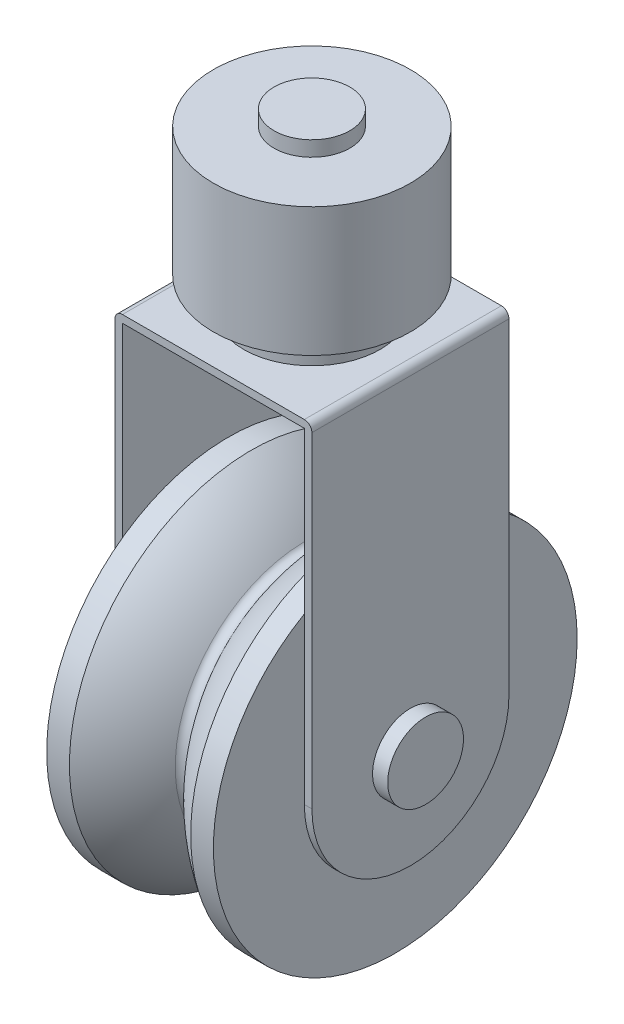
from build123d import *

# Parameters (mm, degrees)
FILLET_1_R                  = 1
EXTRUDE_1_DEPTH             = 13
EXTRUDE_3_DEPTH             = 1
EXTRUDE_4_REACH             = 58.462
SKETCH_5_R                  = 5
EXTRUDE_4_DIRECTION_2_DEPTH = 2
SKETCH_8_R                  = 9
EXTRUDE_5_DEPTH             = 4
SKETCH_9_R                  = 13
EXTRUDE_6_DEPTH             = 17
SKETCH_10_R                 = 5
EXTRUDE_7_DEPTH             = 2
FILLET_3_R                  = 1


with BuildPart() as part:
    # 草图1 → 旋转1 (revolve)
    with BuildSketch(Plane.XY, mode=Mode.PRIVATE) as revolve_1_sk:
        with BuildLine():
            Line((-11, 0), (0, 0))
            Line((0, 0), (0, 16))
            add(Edge.make_bspline(
                [(0, 16), (-3.200328023, 21.071332496), (-8, 24)],
                knots=[0, 0, 0, 0.822363045, 0.822363045, 0.822363045], degree=2))
            Line((-8, 24), (-11, 24))
            Line((-11, 24), (-11, 0))
        make_face()
        with BuildLine():
            Line((0, 16), (0, 0))
            Line((0, 0), (11, 0))
            Line((11, 0), (11, 24))
            Line((11, 24), (8, 24))
            add(Edge.make_bspline(
                [(0, 16), (3.200328023, 21.071332496), (8, 24)],
                knots=[0, 0, 0, 0.822363045, 0.822363045, 0.822363045], degree=2))
        make_face()
    revolve(revolve_1_sk.sketch.rotate(Axis((11, 0, 0), (-1, 0, 0)), 90), axis=Axis((11, 0, 0), (-1, 0, 0)))

    # 圆角1
    fillet_1_edges = [part.edges().sort_by_distance(p)[0] for p in [
        (0, 0, 16),
    ]]
    fillet(fillet_1_edges, radius=FILLET_1_R)

    # 凸台-拉伸4: up to this face of the body (flat: up to its plane)
    extrude_4_end = Plane(part.part.faces().sort_by_distance((11, 0, 0))[0])
    # 草图5 → 凸台-拉伸4 (add, up to the picked face)
    with BuildSketch(Plane(origin=(13, 0, 0), x_dir=(0, 0, -1), z_dir=(1, 0, 0)), mode=Mode.PRIVATE) as extrude_4_sk1:
        with Locations(Location((0, 0, 0), (0, 0, 180))):
            Circle(SKETCH_5_R)
    extrude_4_tool1 = split(extrude(extrude_4_sk1.sketch, amount=-EXTRUDE_4_REACH, mode=Mode.PRIVATE), bisect_by=extrude_4_end, keep=Keep.BOTH, mode=Mode.PRIVATE)


with BuildPart() as body_2:
    # 草图2 → 凸台-拉伸1 (new, symmetric)
    with BuildSketch(Plane.XY):
        Polygon((-12, 0), (-12, 43), (12, 43), (12, 0), (13, 0), (13, 44), (-13, 44), (-13, 0), align=None)
    extrude(amount=EXTRUDE_1_DEPTH, both=True)


with BuildPart() as body_3:
    # 草图4 → 凸台-拉伸3 (new body)
    with BuildSketch(Plane(origin=(13, 0, 0), x_dir=(0, 0, -1), z_dir=(1, 0, 0))):
        with BuildLine():
            ThreePointArc((13, 0), (0, -13), (-13, 0))
            Line((-13, 0), (13, 0))
        make_face()
    extrude(amount=-EXTRUDE_3_DEPTH)


with BuildPart() as part_1:
    add(part.part)

    add(body_2.part)  # 凸台-拉伸4 merges body 2

    add(body_3.part)  # 凸台-拉伸4 merges body 3
    add(extrude_4_tool1.solids().sort_by(Axis((13, 0, 0), (-1, 0, 0)))[0])

    # 草图5 → 凸台-拉伸4 direction 2 (add)
    with BuildSketch(Plane(origin=(13, 0, 0), x_dir=(0, 0, -1), z_dir=(1, 0, 0))):
        with Locations(Location((0, 0, 0), (0, 0, 180))):
            Circle(SKETCH_5_R)
    extrude(amount=EXTRUDE_4_DIRECTION_2_DEPTH)


with BuildPart() as body_2_2:
    # 镜向9: mirrored copy
    add(part_1.part.mirror(Plane(origin=(0, 0, 0), x_dir=(0, 0, 1), z_dir=(1, 0, 0))))


with BuildPart() as part_2:
    add(part_1.part)

    add(body_2_2.part)  # 凸台-拉伸5 merges body 2 2
    # 草图8 → 凸台-拉伸5 (add)
    with BuildSketch(Plane(origin=(0, 44, 0), x_dir=(1, 0, 0), z_dir=(0, 1, 0))):
        with Locations(Location((0, 0, 0), (0, 0, 270))):
            Circle(SKETCH_8_R)
    extrude(amount=EXTRUDE_5_DEPTH)

    # 草图9 → 凸台-拉伸6 (add)
    with BuildSketch(Plane(origin=(0, 48, 0), x_dir=(1, 0, 0), z_dir=(0, 1, 0))):
        with Locations(Location((0, 0, 0), (0, 0, 270))):
            Circle(SKETCH_9_R)
    extrude(amount=EXTRUDE_6_DEPTH)

    # 草图10 → 凸台-拉伸7 (add)
    with BuildSketch(Plane(origin=(0, 65, 0), x_dir=(1, 0, 0), z_dir=(0, 1, 0))):
        with Locations(Location((0, 0, 0), (0, 0, 270))):
            Circle(SKETCH_10_R)
    extrude(amount=EXTRUDE_7_DEPTH)

    # 圆角3
    fillet_3_edges = [part_2.edges().sort_by_distance(p)[0] for p in [
        (-13, 44, 0),
        (13, 44, 0),
    ]]
    fillet(fillet_3_edges, radius=FILLET_3_R)


solid = part_2.part
